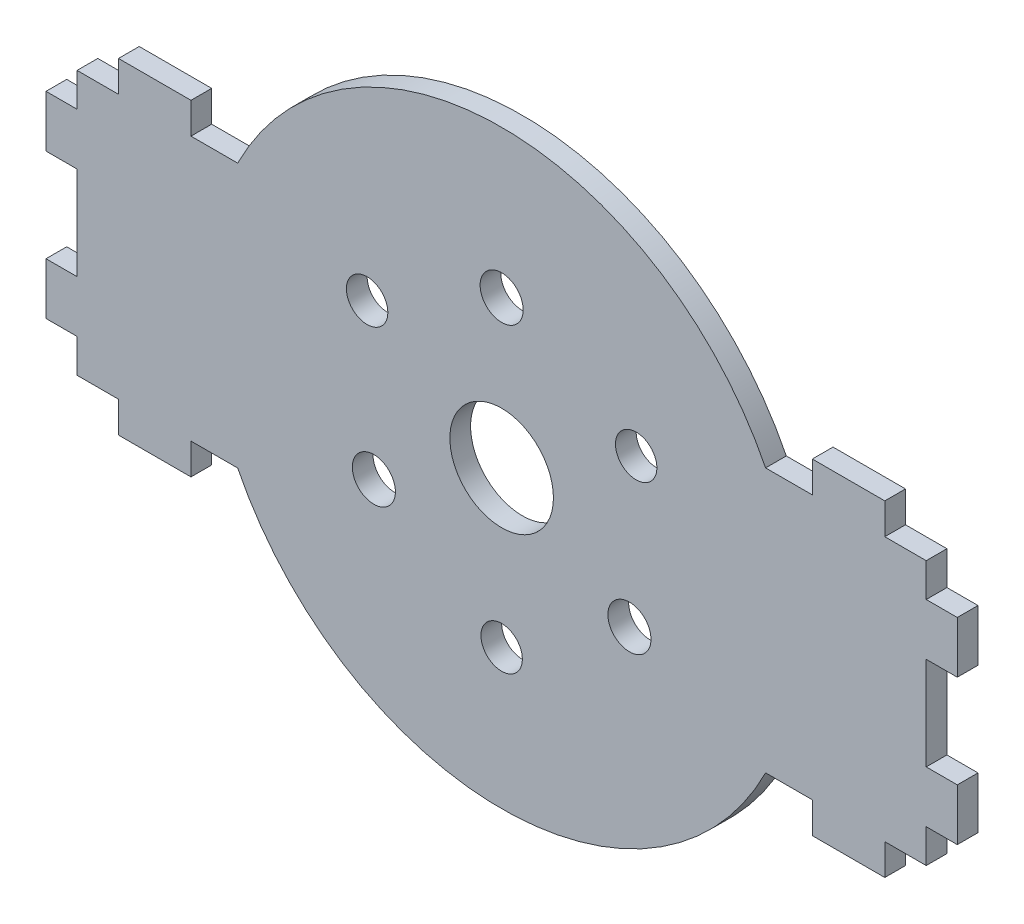
from build123d import *

# Parameters (mm, degrees)
SKETCH_1_R      = 2
SKETCH_1_R_2    = 2.08
SKETCH_1_R_3    = 5
EXTRUDE_2_DEPTH = 2


with BuildPart() as part:
    # 草图1 → 凸台-拉伸2 (new body)
    with BuildSketch(Plane.XY):
        with BuildLine():
            Line((-41, -12.75), (-37, -12.75))
            Line((-37, -12.75), (-37, -15.75))
            Line((-37, -15.75), (-30, -15.75))
            Line((-30, -15.75), (-30, -12.75))
            Line((-30, -12.75), (-25.488968202, -12.75))
            ThreePointArc((-25.488968202, -12.75), (0, -28.5), (25.488968202, -12.75))
            Line((25.488968202, -12.75), (30, -12.75))
            Line((30, -12.75), (30, -15.75))
            Line((30, -15.75), (37, -15.75))
            Line((37, -15.75), (37, -12.75))
            Line((37, -12.75), (41, -12.75))
            Line((41, -12.75), (41, -9.5))
            Line((41, -9.5), (44, -9.5))
            Line((44, -9.5), (44, -4.5))
            Line((44, -4.5), (41, -4.5))
            Line((41, -4.5), (41, 4.5))
            Line((41, 4.5), (44, 4.5))
            Line((44, 4.5), (44, 9.5))
            Line((44, 9.5), (41, 9.5))
            Line((41, 9.5), (41, 12.75))
            Line((41, 12.75), (37, 12.75))
            Line((37, 12.75), (37, 15.75))
            Line((37, 15.75), (30, 15.75))
            Line((30, 15.75), (30, 12.75))
            Line((30, 12.75), (25.488968202, 12.75))
            ThreePointArc((25.488968202, 12.75), (0, 28.5), (-25.488968202, 12.75))
            Line((-25.488968202, 12.75), (-30, 12.75))
            Line((-30, 12.75), (-30, 15.75))
            Line((-30, 15.75), (-37, 15.75))
            Line((-37, 15.75), (-37, 12.75))
            Line((-37, 12.75), (-41, 12.75))
            Line((-41, 12.75), (-41, 9.5))
            Line((-41, 9.5), (-44, 9.5))
            Line((-44, 9.5), (-44, 4.5))
            Line((-44, 4.5), (-41, 4.5))
            Line((-41, 4.5), (-41, -4.5))
            Line((-41, -4.5), (-44, -4.5))
            Line((-44, -4.5), (-44, -9.5))
            Line((-44, -9.5), (-41, -9.5))
            Line((-41, -9.5), (-41, -12.75))
        make_face()
        with Locations((12.990381057, 7.5)):
            Circle(SKETCH_1_R, mode=Mode.SUBTRACT)
        with Locations((0, 14.25)):
            Circle(SKETCH_1_R_2, mode=Mode.SUBTRACT)
        with Locations((-12.990381057, 7.5)):
            Circle(SKETCH_1_R, mode=Mode.SUBTRACT)
        with Locations((-12.340862004, -7.125)):
            Circle(SKETCH_1_R_2, mode=Mode.SUBTRACT)
        with Locations((0, -15)):
            Circle(SKETCH_1_R, mode=Mode.SUBTRACT)
        with Locations((12.340862004, -7.125)):
            Circle(SKETCH_1_R_2, mode=Mode.SUBTRACT)
        Circle(SKETCH_1_R_3, mode=Mode.SUBTRACT)
    extrude(amount=EXTRUDE_2_DEPTH)


solid = part.part
